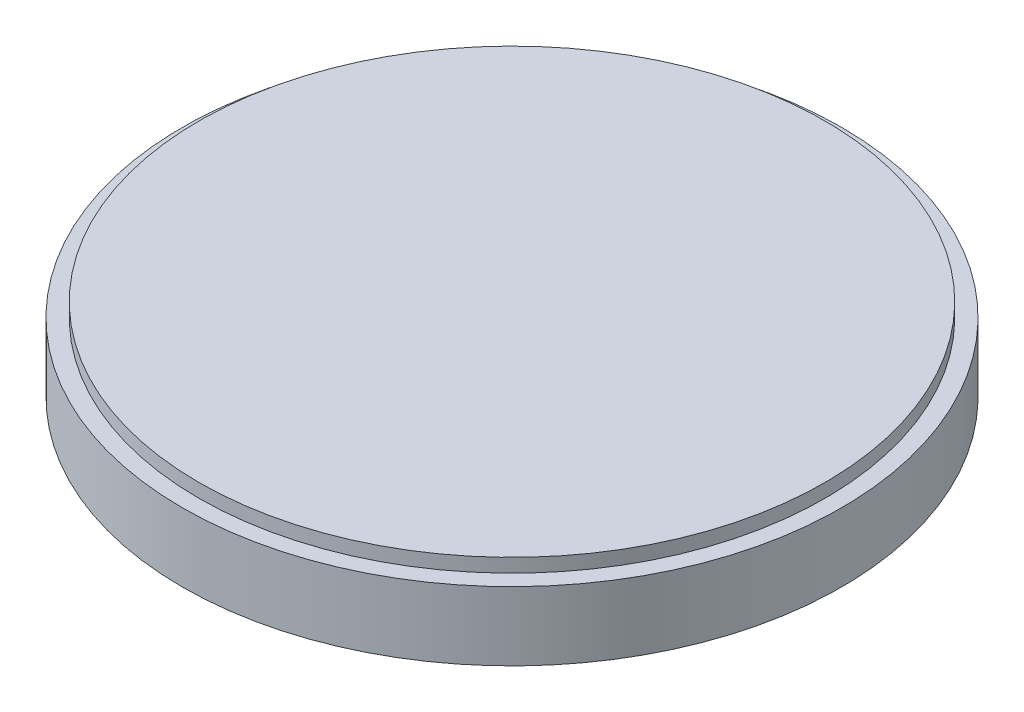
from build123d import *

# Parameters (mm, degrees)
SKETCH1_R           = 57
EXTRUDE4_DEPTH      = 7.5
EXTRUDE5_DEPTH      = 5
EXTRUDE5_DEPTH_BACK = 7.5
SKETCH_R            = 60
SKETCH_R_2          = 57


with BuildPart() as part:
    # Sketch1 → Extrude4 (new, symmetric)
    with BuildSketch(Plane(origin=(0, 0, 0), x_dir=(1, 0, 0), z_dir=(0, 1, 0))):
        with Locations(Location((0, 0, 0), (0, 0, 270))):
            Circle(SKETCH1_R)
    extrude(amount=EXTRUDE4_DEPTH, both=True)

    # Sketch → Extrude5 (add, two sides: drawn at the far end of the back side and taken through both)
    with BuildSketch(Plane(origin=(0, 0, 0), x_dir=(1, 0, 0), z_dir=(0, 1, 0)).offset(-EXTRUDE5_DEPTH_BACK)):
        with Locations(Location((0, 0, 0), (0, 0, 270))):
            Circle(SKETCH_R)
        with Locations(Location((0, 0, 0), (0, 0, 270))):
            Circle(SKETCH_R_2, mode=Mode.SUBTRACT)
    extrude(amount=EXTRUDE5_DEPTH + EXTRUDE5_DEPTH_BACK)


solid = part.part
